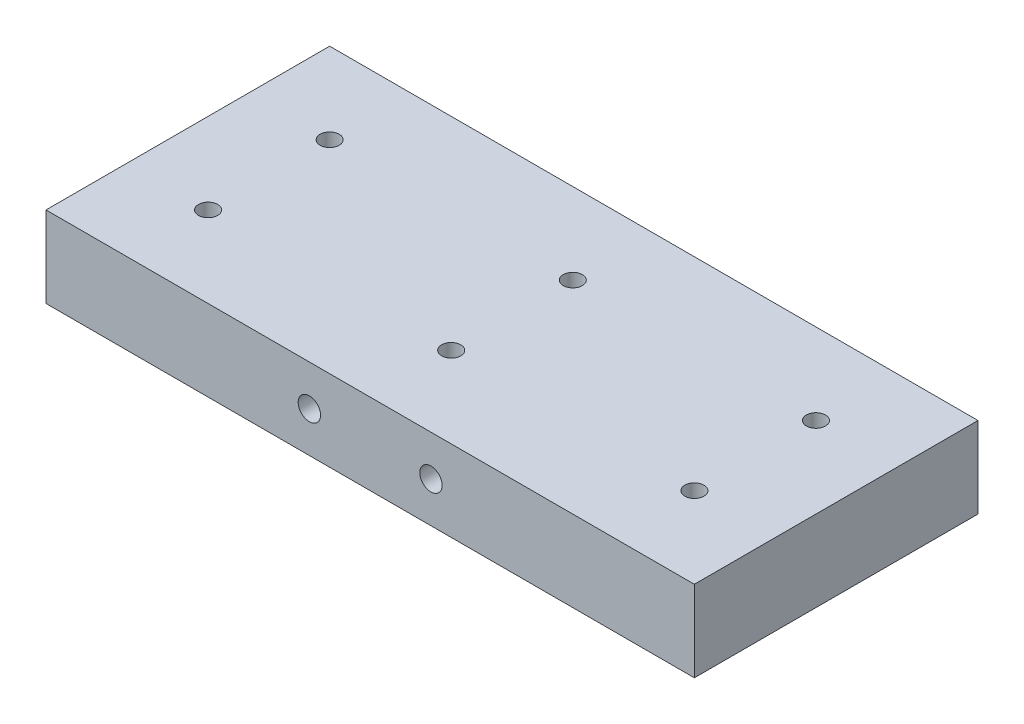
from build123d import *

# Parameters (mm, degrees)
SKETCH1_W                 = 44.45
SKETCH1_H                 = 12.7
BOSS_EXTRUDE1_DEPTH       = 50.8
M3_10_THREADED_HOLE_D     = 3
M3_10_THREADED_HOLE_DEPTH = 6.35
M3_10_THREADED_HOLE_TIP   = 0.901290929
F_6_32_THREADED_HOLE_D    = 3.51028


with BuildPart() as part:
    # Sketch1 → Boss-Extrude1 (new, symmetric)
    with BuildSketch(Plane(origin=(0, 0, 0), x_dir=(0, 0, -1), z_dir=(1, 0, 0))):
        Rectangle(SKETCH1_W, SKETCH1_H)
    extrude(amount=BOSS_EXTRUDE1_DEPTH, both=True)

    # M3-10 Threaded Hole
    with Locations(Plane(origin=(0, 6.35, 0), x_dir=(1, 0, 0), z_dir=(0, 1, 0))):
        with Locations((-38.1, -9.525), (0, -9.525), (38.1, -9.525), (-38.1, 9.525), (0, 9.525), (38.1, 9.525)):
            Hole(M3_10_THREADED_HOLE_D / 2, depth=M3_10_THREADED_HOLE_DEPTH)
            with Locations((0, 0, -(M3_10_THREADED_HOLE_DEPTH + M3_10_THREADED_HOLE_TIP / 2))):  # 118° drill point
                Cone(0, M3_10_THREADED_HOLE_D / 2, M3_10_THREADED_HOLE_TIP, mode=Mode.SUBTRACT)

    # #6-32 Threaded Hole (through all)
    with Locations(Plane.XY.offset(22.225)):
        with Locations((-9.525, 0), (9.525, 0)):
            Hole(F_6_32_THREADED_HOLE_D / 2)


solid = part.part
